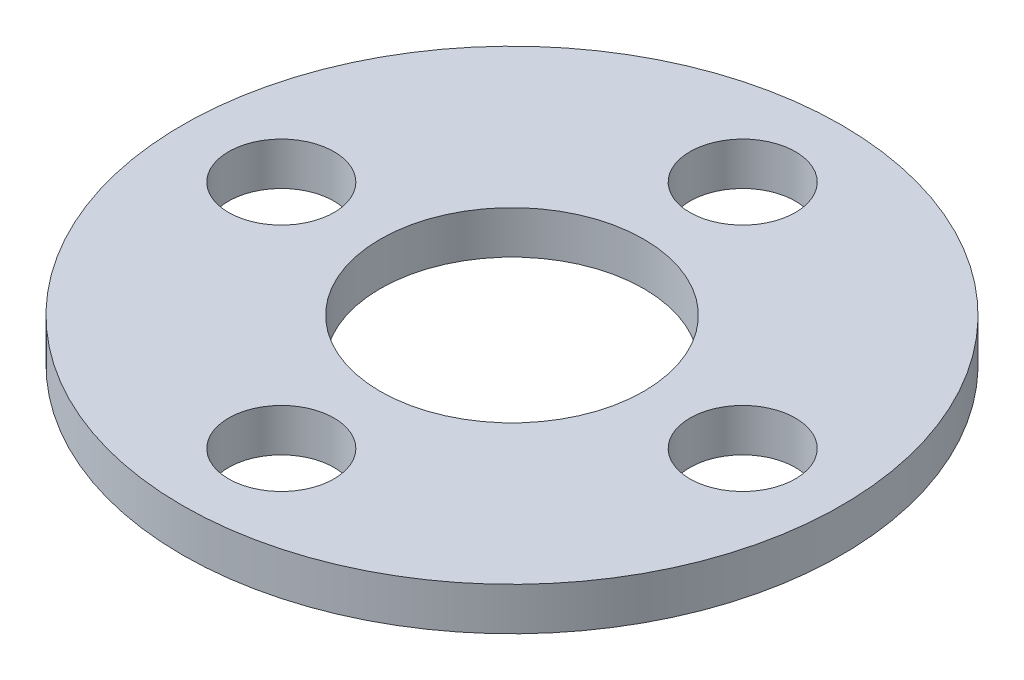
from build123d import *

# Parameters (mm, degrees)
SKETCH_1_R      = 10
SKETCH_1_R_2    = 4
SKETCH_1_R_3    = 1.6
EXTRUDE_1_DEPTH = 1.3


with BuildPart() as part:
    # 草图1 → 凸台-拉伸1 (new body)
    with BuildSketch(Plane(origin=(0, 0, 0), x_dir=(1, 0, 0), z_dir=(0, 1, 0))):
        with Locations(Location((0, 0, 0), (0, 0, 270))):
            Circle(SKETCH_1_R)
        with Locations(Location((0, 0, 0), (0, 0, 270))):
            Circle(SKETCH_1_R_2, mode=Mode.SUBTRACT)
        with Locations(Location((-7, 0, 0), (0, 0, 270))):
            Circle(SKETCH_1_R_3, mode=Mode.SUBTRACT)
        with Locations(Location((0, 7, 0), (0, 0, 270))):
            Circle(SKETCH_1_R_3, mode=Mode.SUBTRACT)
        with Locations(Location((7, 0, 0), (0, 0, 270))):
            Circle(SKETCH_1_R_3, mode=Mode.SUBTRACT)
        with Locations(Location((0, -7, 0), (0, 0, 270))):
            Circle(SKETCH_1_R_3, mode=Mode.SUBTRACT)
    extrude(amount=EXTRUDE_1_DEPTH)


solid = part.part
